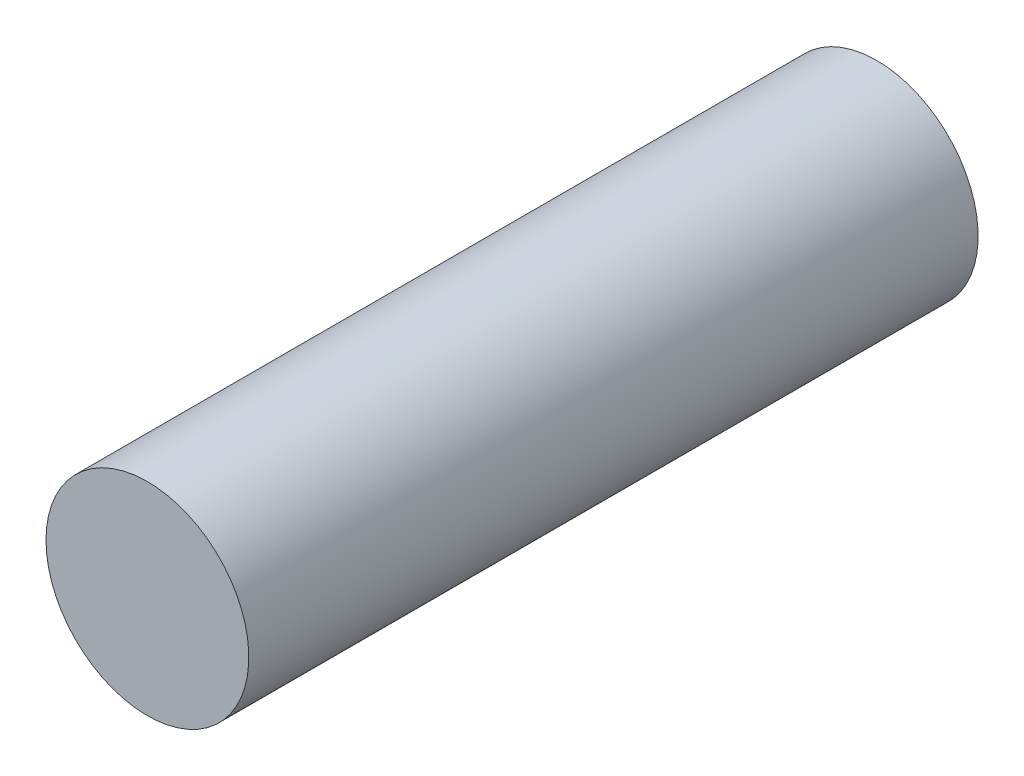
from build123d import *

# Parameters (mm, degrees)
SKETCH1_R           = 3.302
BOSS_EXTRUDE1_DEPTH = 11.8745


with BuildPart() as part:
    # Sketch1 → Boss-Extrude1 (new, symmetric)
    with BuildSketch(Plane.XY):
        with Locations(Location((0, 0, 0), (0, 0, 180))):
            Circle(SKETCH1_R)
    extrude(amount=BOSS_EXTRUDE1_DEPTH, both=True)


solid = part.part
